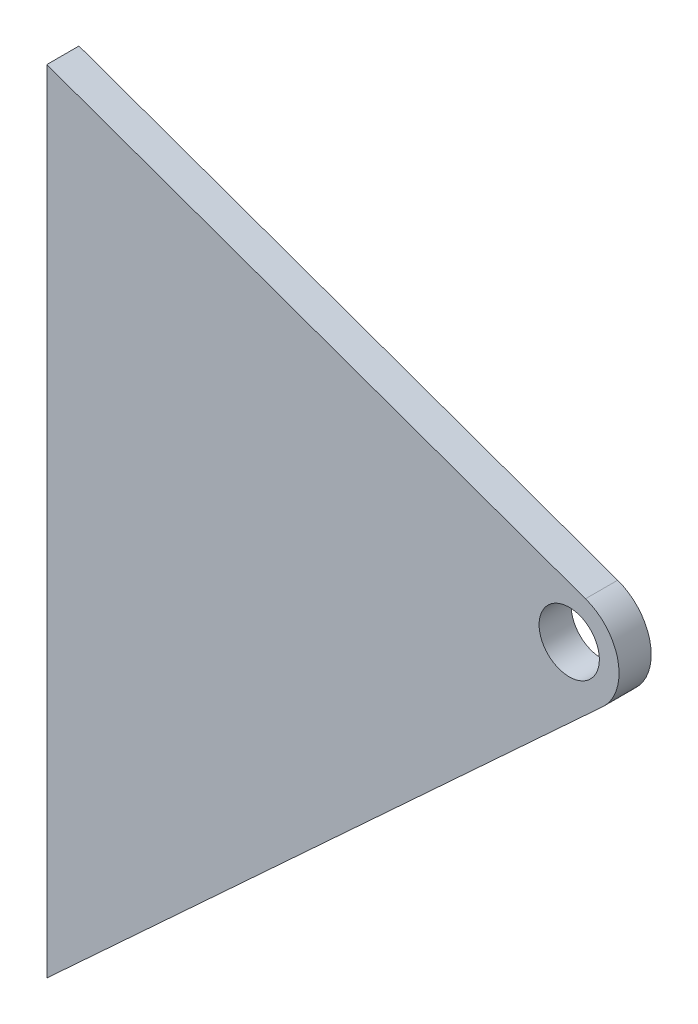
from build123d import *

# Parameters (mm, degrees)
SKETCH1_R           = 9.525
BOSS_EXTRUDE1_DEPTH = 10.16
FILLET1_R           = 16


with BuildPart() as part:
    # Sketch1 → Boss-Extrude1 (new body)
    with BuildSketch(Plane.XY):
        Polygon((0, 0), (0, 250), (195.1, 180), align=None)
        with Locations((165.1, 174.5)):
            Circle(SKETCH1_R, mode=Mode.SUBTRACT)
    extrude(amount=BOSS_EXTRUDE1_DEPTH)

    # Fillet1
    fillet1_edges = [part.edges().sort_by_distance(p)[0] for p in [
        (195.1, 180, 5.08),
    ]]
    fillet(fillet1_edges, radius=FILLET1_R)


solid = part.part
